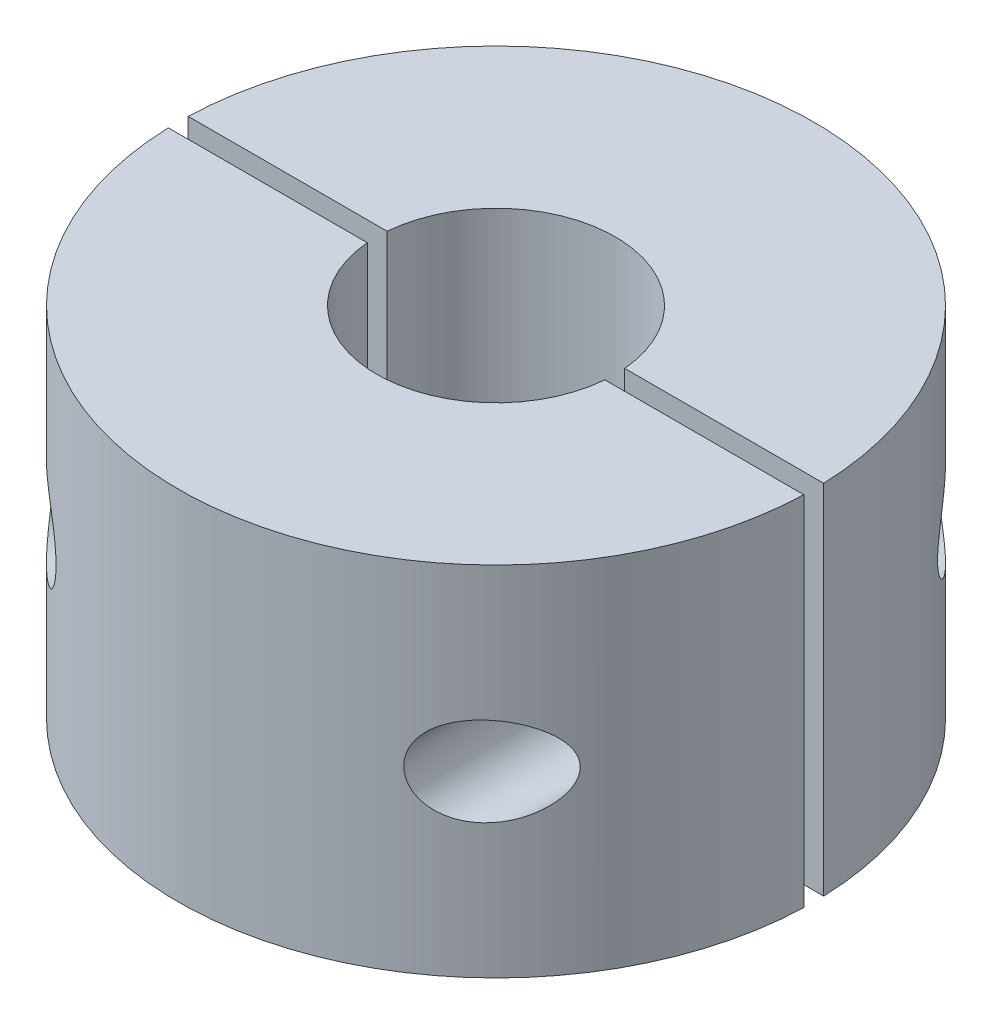
from build123d import *

# Parameters (mm, degrees)
SKETCH_1_R               = 8
EXTRUDE_1_DEPTH          = 9
SKETCH_3_R               = 3
CUT_EXTRUDE_2_DEPTH      = 15.456832295
SKETCH_5_W               = 20
SKETCH_5_H               = 0.5
CUT_EXTRUDE_4_DEPTH      = 15.456832295
CUT_EXTRUDE_5_DEPTH      = 15.454670525
CUT_EXTRUDE_5_DEPTH_BACK = 15.454670525
SKETCH_6_R               = 1.12021095


with BuildPart() as part:
    # 草图1 → 凸台-拉伸1 (new body)
    with BuildSketch(Plane(origin=(0, 0, 0), x_dir=(1, 0, 0), z_dir=(0, 1, 0))):
        with Locations(Location((0, 0, 0), (0, 0, 270))):
            Circle(SKETCH_1_R)
    extrude(amount=EXTRUDE_1_DEPTH)

    # 草图3 → 切除-拉伸2 (cut, through all)
    with BuildSketch(Plane(origin=(0, 9, 0), x_dir=(1, 0, 0), z_dir=(0, 1, 0))):
        with Locations(Location((0, 0, 0), (0, 0, 270))):
            Circle(SKETCH_3_R)
    extrude(amount=-CUT_EXTRUDE_2_DEPTH, mode=Mode.SUBTRACT)

    # 草图5 → 切除-拉伸4 (cut, through all)
    with BuildSketch(Plane(origin=(0, 9, 0), x_dir=(1, 0, 0), z_dir=(0, 1, 0))):
        Rectangle(SKETCH_5_W, SKETCH_5_H)
    extrude(amount=-CUT_EXTRUDE_4_DEPTH, mode=Mode.SUBTRACT)


with BuildPart() as cut_extrude_4_piece_1:
    # of the separate pieces the step leaves, piece 1, a body of its own (cut_extrude_4_pieces)
    add(part.part.solids().sort_by_distance((-7.996092796, 0, 0.25))[0])


with BuildPart() as cut_extrude_4_piece_2:
    # of the separate pieces the step leaves, piece 2, a body of its own (cut_extrude_4_pieces)
    add(part.part.solids().sort_by_distance((7.996092796, 0, -0.25))[0])


with BuildPart() as cut_extrude_5_tool:
    # 草图6 → 切除-拉伸5 (new, two sides: drawn at the far end of the back side and taken through both)
    with BuildSketch(Plane.XY.offset(-CUT_EXTRUDE_5_DEPTH_BACK)):
        with Locations((5.496092796, 4.5)):
            Circle(SKETCH_6_R)
        with Locations((-5.496092796, 4.5)):
            Circle(SKETCH_6_R)
    extrude(amount=CUT_EXTRUDE_5_DEPTH + CUT_EXTRUDE_5_DEPTH_BACK)


with BuildPart() as cut_extrude_4_piece_1_1:
    add(cut_extrude_4_piece_1.part)

    # 切除-拉伸5: cut by cut_extrude_5_tool
    add(cut_extrude_5_tool.part, mode=Mode.SUBTRACT)


with BuildPart() as cut_extrude_4_piece_2_1:
    add(cut_extrude_4_piece_2.part)

    # 切除-拉伸5: cut by cut_extrude_5_tool
    add(cut_extrude_5_tool.part, mode=Mode.SUBTRACT)


solid = Compound([cut_extrude_4_piece_1_1.part, cut_extrude_4_piece_2_1.part])
